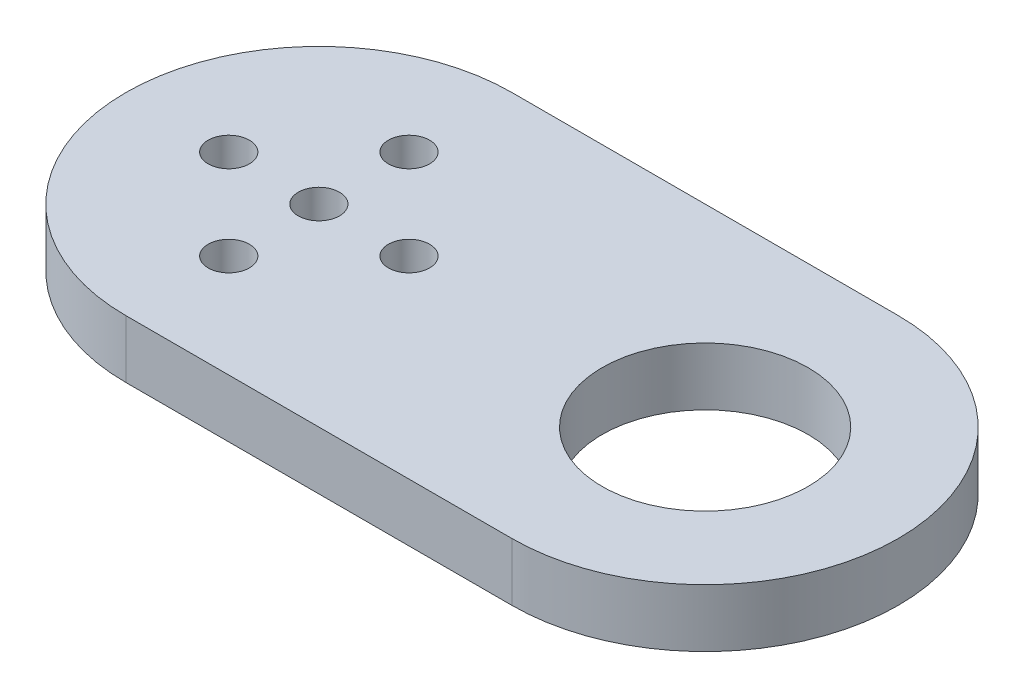
from build123d import *

# Parameters (mm, degrees)
BOSS_EXTRUDE1_DEPTH     = 4.5
SKETCH4_R               = 1.6
SERVO_HORN_HOLES_DEPTH  = 34.841542518
SKETCH5_R               = 8
BEARING_PRESS_FIT_DEPTH = 34.841542518


with BuildPart() as part:
    # Sketch2 → Boss-Extrude1 (new body)
    with BuildSketch(Plane(origin=(0, 0, 0), x_dir=(1, 0, 0), z_dir=(0, 1, 0))):
        with BuildLine():
            Line((15, 15), (-15, 15))
            ThreePointArc((-15, 15), (-30, 0), (-15, -15))
            Line((-15, -15), (15, -15))
            ThreePointArc((15, -15), (30, 0), (15, 15))
        make_face()
    extrude(amount=BOSS_EXTRUDE1_DEPTH)

    # Sketch4 → Servo horn holes (cut, through all)
    with BuildSketch(Plane(origin=(0, 4.5, 0), x_dir=(1, 0, 0), z_dir=(0, 1, 0))):
        with Locations(Location((-15, 0, 0), (0, 0, 270))):
            Circle(SKETCH4_R)
        with Locations(Location((-8, 0, 0), (0, 0, 270))):
            Circle(SKETCH4_R)
        with Locations(Location((-15, -7, 0), (0, 0, 270))):
            Circle(SKETCH4_R)
        with Locations(Location((-22, 0, 0), (0, 0, 270))):
            Circle(SKETCH4_R)
        with Locations(Location((-15, 7, 0), (0, 0, 270))):
            Circle(SKETCH4_R)
    extrude(amount=-SERVO_HORN_HOLES_DEPTH, mode=Mode.SUBTRACT)

    # Sketch5 → Bearing press fit (cut, through all)
    with BuildSketch(Plane(origin=(0, 0, 0), x_dir=(-1, 0, 0), z_dir=(0, -1, 0))):
        with Locations(Location((-15, 0, 0), (0, 0, 90))):
            Circle(SKETCH5_R)
    extrude(amount=-BEARING_PRESS_FIT_DEPTH, mode=Mode.SUBTRACT)


solid = part.part
